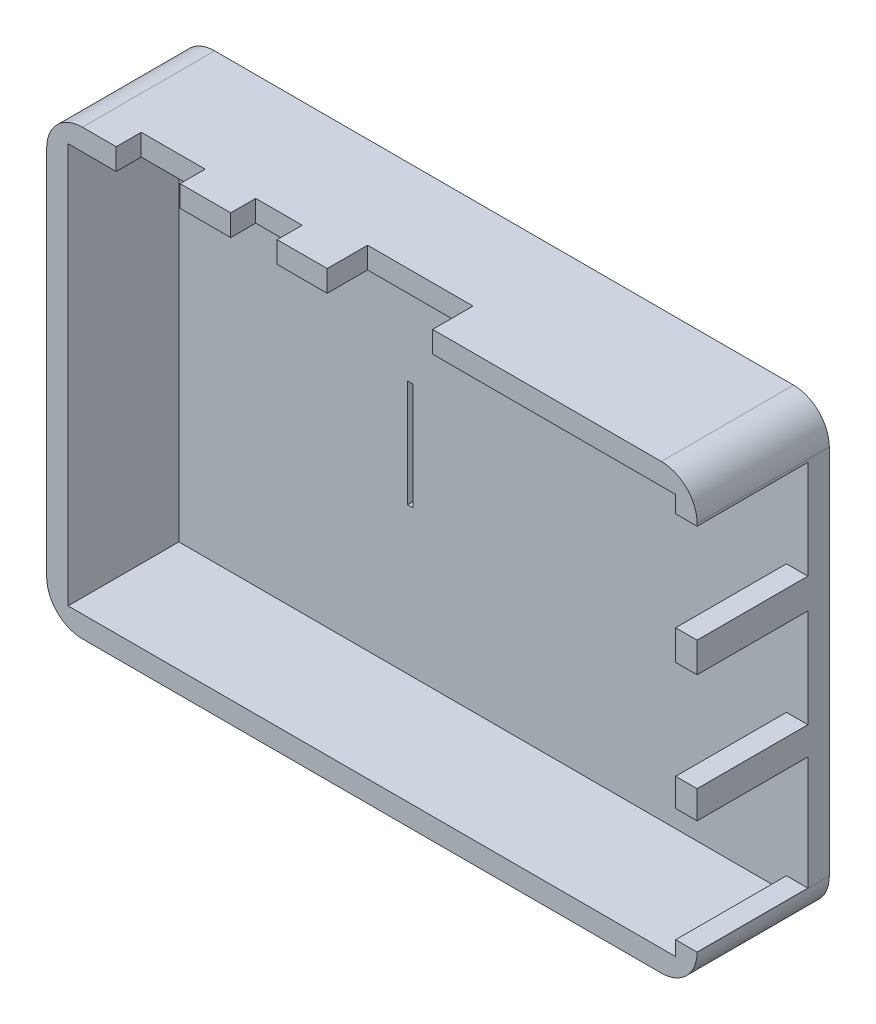
from build123d import *

# Parameters (mm, degrees)
SKETCH1_W           = 91
SKETCH1_H           = 62
BOSS_EXTRUDE1_DEPTH = 3
SKETCH2_W           = 91
SKETCH2_H           = 62
SKETCH2_W_2         = 85
SKETCH2_H_2         = 56
BOSS_EXTRUDE2_DEPTH = 15.5
FILLET1_R           = 5
SKETCH3_W           = 3
SKETCH3_H           = 15.9
SKETCH3_H_2         = 13.8
CUT_EXTRUDE2_DEPTH  = 15.5
SKETCH4_W           = 8.94
SKETCH4_H           = 3
SKETCH4_W_2         = 6.5
CUT_EXTRUDE3_DEPTH  = 3.5
SKETCH5_W           = 14.75
SKETCH5_H           = 3
CUT_EXTRUDE4_DEPTH  = 5.65
SKETCH6_W           = 0.75
SKETCH6_H           = 15
CUT_EXTRUDE5_DEPTH  = 3


with BuildPart() as part:
    # Sketch1 → Boss-Extrude1 (new body)
    with BuildSketch(Plane.XY):
        Rectangle(SKETCH1_W, SKETCH1_H)
    extrude(amount=BOSS_EXTRUDE1_DEPTH)

    # Sketch2 → Boss-Extrude2 (add)
    with BuildSketch(Plane.XY.offset(3)):
        Rectangle(SKETCH2_W, SKETCH2_H)
        Rectangle(SKETCH2_W_2, SKETCH2_H_2, mode=Mode.SUBTRACT)
    extrude(amount=BOSS_EXTRUDE2_DEPTH)

    # Fillet1
    fillet1_edges = [part.edges().sort_by_distance(p)[0] for p in [
        (45.5, -31, 9.25),
        (-45.5, -31, 9.25),
        (-45.5, 31, 9.25),
        (45.5, 31, 9.25),
    ]]
    fillet(fillet1_edges, radius=FILLET1_R)

    # Sketch3 → Cut-Extrude2 (cut)
    with BuildSketch(Plane.XY.offset(18.5)):
        with Locations((44, -18)):
            Rectangle(SKETCH3_W, SKETCH3_H)
        with Locations((44, 0.75)):
            Rectangle(SKETCH3_W, SKETCH3_H_2)
        with Locations((44, 18.75)):
            Rectangle(SKETCH3_W, SKETCH3_H_2)
    extrude(amount=-CUT_EXTRUDE2_DEPTH, mode=Mode.SUBTRACT)

    # Sketch4 → Cut-Extrude3 (cut)
    with BuildSketch(Plane.XY.offset(18.5)):
        with Locations((-31.3, 29.5)):
            Rectangle(SKETCH4_W, SKETCH4_H)
        with Locations((-16.5, 29.5)):
            Rectangle(SKETCH4_W_2, SKETCH4_H)
        with Locations((-3, 29.5)):
            Rectangle(SKETCH4_W_2, SKETCH4_H)
    extrude(amount=-CUT_EXTRUDE3_DEPTH, mode=Mode.SUBTRACT)

    # Sketch5 → Cut-Extrude4 (cut)
    with BuildSketch(Plane.XY.offset(18.5)):
        with Locations((1.125, 29.5)):
            Rectangle(SKETCH5_W, SKETCH5_H)
    extrude(amount=-CUT_EXTRUDE4_DEPTH, mode=Mode.SUBTRACT)

    # Sketch6 → Cut-Extrude5 (cut)
    with BuildSketch(Plane(origin=(0, 0, 0), x_dir=(-1, 0, 0), z_dir=(0, 0, -1))):
        with Locations((10.125, 0)):
            Rectangle(SKETCH6_W, SKETCH6_H)
    extrude(amount=-CUT_EXTRUDE5_DEPTH, mode=Mode.SUBTRACT)


solid = part.part
